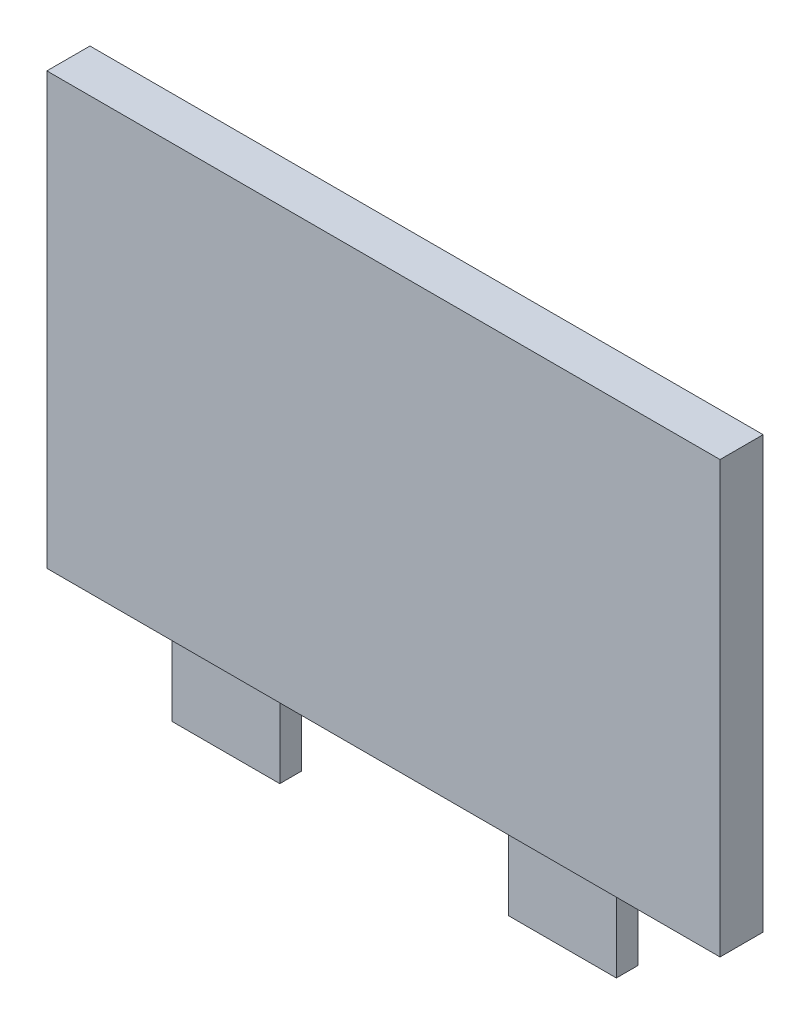
from build123d import *

# Parameters (mm, degrees)
SKETCH_1_W      = 125
SKETCH_1_H      = 8
EXTRUDE_1_DEPTH = 80
SKETCH_3_W      = 20
SKETCH_3_H      = 4
EXTRUDE_2_DEPTH = 15


with BuildPart() as part:
    # 草图1 → 凸台-拉伸1 (new body)
    with BuildSketch(Plane(origin=(0, 0, 0), x_dir=(1, 0, 0), z_dir=(0, 1, 0))):
        with Locations((62.5, 4)):
            Rectangle(SKETCH_1_W, SKETCH_1_H)
    extrude(amount=EXTRUDE_1_DEPTH)

    # 草图3 → 凸台-拉伸2 (add)
    with BuildSketch(Plane.XZ):
        with Locations((31.25, -4)):
            Rectangle(SKETCH_3_W, SKETCH_3_H)
        with Locations((93.75, -4)):
            Rectangle(SKETCH_3_W, SKETCH_3_H)
    extrude(amount=EXTRUDE_2_DEPTH)


solid = part.part
